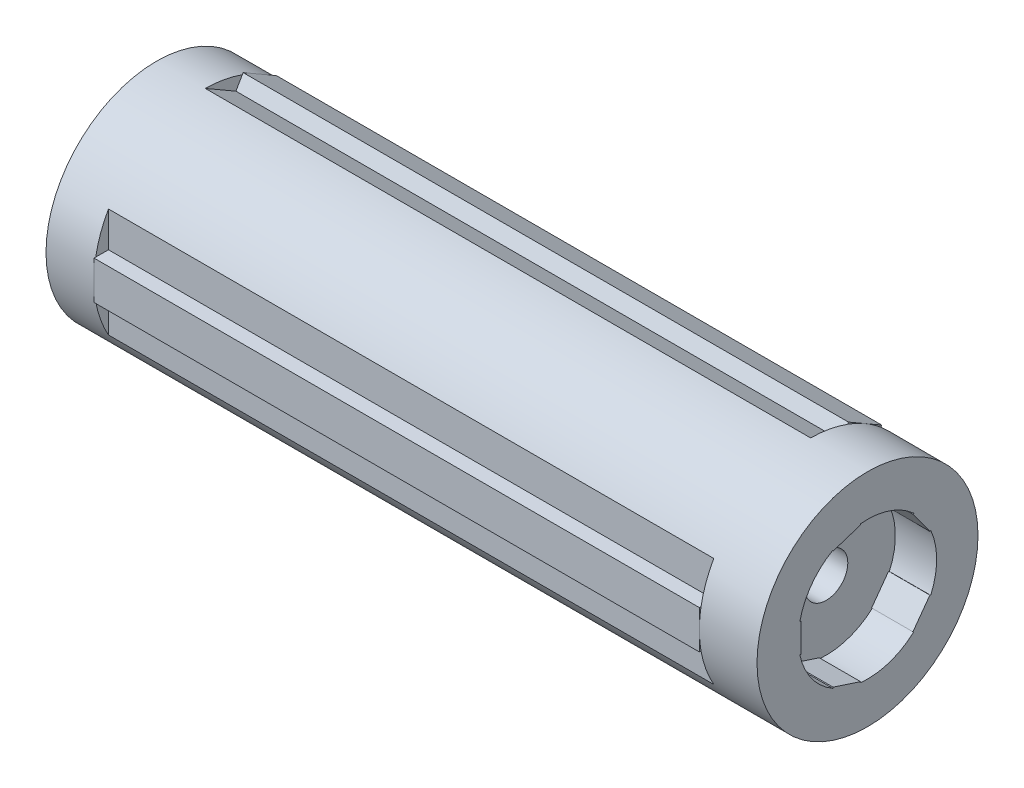
from build123d import *

# Parameters (mm, degrees)
SKIZZE1_R                                 = 11.5
GRUNDK_RPER_WALZE_DEPTH                   = 74
PRESSPASSUNG_KUGELLAGER_DEPTH             = 4.3
SKIZZE3_R                                 = 2.25
M4_SCHRAUBENF_HRUNG_DEPTH                 = 4.5
SKIZZE4_R                                 = 9.6
MOTORAUSSPARUNG_DEPTH                     = 12.75
ZERST_RUNGSELEMENT_START                  = -6
SKIZZE7_W                                 = 1.5
SKIZZE7_H                                 = 15
ZERST_RUNGSELEMENT_AUSSPARUNG_DEPTH       = 63
SKIZZE8_W                                 = 63
SKIZZE8_H                                 = 4
ZERST_RUNGSELEMENT_RECHTECK_DEPTH         = 1.5
M5_MOTOR_MUTTER_DEPTH                     = 12
SKIZZE12_R                                = 3.1
M5_AUSLAUF_SCHRAUBE_DEPTH                 = 2
ZERST_RUNGSELEMENT_VERVIELF_LTIGUNG_COUNT = 3
SKIZZE13_R                                = 8.5
INNENAUSPARUNG_HOHL_DEPTH                 = 38


with BuildPart() as part:
    # Skizze1 → Grundkörper Walze (new body)
    with BuildSketch(Plane(origin=(0, 0, 0), x_dir=(0, 0, -1), z_dir=(1, 0, 0))):
        Circle(SKIZZE1_R)
    extrude(amount=GRUNDK_RPER_WALZE_DEPTH)

    # Skizze2 → Presspassung Kugellager (cut)
    with BuildSketch(Plane(origin=(74, 0, 0), x_dir=(0, 0, -1), z_dir=(1, 0, 0))):
        with BuildLine():
            Line((-7.040453047, 1.507322425), (-6.940453047, 1.507322425))
            Line((-6.940453047, 1.507322425), (-6.940453047, -1.492677575))
            Line((-6.940453047, -1.492677575), (-7.043572507, -1.492677575))
            ThreePointArc((-7.043572507, -1.492677575), (-5.829319782, -4.225994662), (-3.609168454, -6.230080503))
            Line((-3.609168454, -6.230080503), (-3.578266755, -6.134974851))
            Line((-3.578266755, -6.134974851), (-0.725097206, -7.062025834))
            Line((-0.725097206, -7.062025834), (-0.756962871, -7.160098268))
            ThreePointArc((-0.756962871, -7.160098268), (2.217800882, -6.849916733), (4.809864271, -5.357723928))
            Line((4.809864271, -5.357723928), (4.728962572, -5.298945403))
            Line((4.728962572, -5.298945403), (6.492318329, -2.87189442))
            Line((6.492318329, -2.87189442), (6.575743724, -2.932506518))
            ThreePointArc((6.575743724, -2.932506518), (7.199996108, -0.007486699), (6.581828055, 2.918825013))
            Line((6.581828055, 2.918825013), (6.500926356, 2.860046487))
            Line((6.500926356, 2.860046487), (4.737570599, 5.28709747))
            Line((4.737570599, 5.28709747), (4.820995994, 5.347709568))
            ThreePointArc((4.820995994, 5.347709568), (2.232041431, 6.845289698), (-0.742070825, 7.161656993))
            Line((-0.742070825, 7.161656993), (-0.711169126, 7.066551342))
            Line((-0.711169126, 7.066551342), (-3.564338674, 6.139500359))
            Line((-3.564338674, 6.139500359), (-3.59620434, 6.237572793))
            ThreePointArc((-3.59620434, 6.237572793), (-5.820518639, 4.238108396), (-7.040453047, 1.507322425))
        make_face()
    extrude(amount=-PRESSPASSUNG_KUGELLAGER_DEPTH, mode=Mode.SUBTRACT)

    # Skizze3 → M4 Schraubenführung (cut)
    with BuildSketch(Plane(origin=(69.7, 0, 0), x_dir=(0, 0, -1), z_dir=(1, 0, 0))):
        Circle(SKIZZE3_R)
    extrude(amount=-M4_SCHRAUBENF_HRUNG_DEPTH, mode=Mode.SUBTRACT)

    # Skizze4 → Motoraussparung (cut)
    with BuildSketch(Plane.ZY):
        Circle(SKIZZE4_R)
    extrude(amount=-MOTORAUSSPARUNG_DEPTH, mode=Mode.SUBTRACT)

    # Skizze7 → Zerstörungselement Aussparung (cut)
    with BuildSketch(Plane(origin=(74, 0, 0), x_dir=(0, 0, -1), z_dir=(1, 0, 0)).offset(ZERST_RUNGSELEMENT_START)):
        with Locations((-10.75, 0)):
            Rectangle(SKIZZE7_W, SKIZZE7_H)
    zerst_rungselement_aussparung = extrude(amount=-ZERST_RUNGSELEMENT_AUSSPARUNG_DEPTH, mode=Mode.SUBTRACT)

    # Skizze8 → Zerstörungselement Rechteck (add)
    with BuildSketch(Plane.XY.offset(10)):
        with Locations((36.5, 0)):
            Rectangle(SKIZZE8_W, SKIZZE8_H)
    zerst_rungselement_rechteck = extrude(amount=ZERST_RUNGSELEMENT_RECHTECK_DEPTH)

    # Skizze10 → M5 Motor Mutter (cut)
    with BuildSketch(Plane.ZY.offset(-12.75)):
        Polygon((4.139835299, -2.29675794), (4.058968371, 2.436823566), (-0.080866927, 4.733581506), (-4.139835299, 2.29675794), (-4.058968371, -2.436823566), (0.080866927, -4.733581506), align=None)
    extrude(amount=-M5_MOTOR_MUTTER_DEPTH, mode=Mode.SUBTRACT)

    # Skizze12 → M5 Auslauf Schraube (cut)
    with BuildSketch(Plane.ZY.offset(-24.75)):
        Circle(SKIZZE12_R)
    extrude(amount=-M5_AUSLAUF_SCHRAUBE_DEPTH, mode=Mode.SUBTRACT)

    # Zerstörungselement Vervielfältigung: Zerstörungselement Aussparung, Zerstörungselement Rechteck ×3 about axis
    zerst_rungselement_vervielf_ltigung_axis = Axis((0, 0, 0), (1, 0, 0))
    add([zerst_rungselement_aussparung.rotate(zerst_rungselement_vervielf_ltigung_axis, i * 360 / ZERST_RUNGSELEMENT_VERVIELF_LTIGUNG_COUNT) for i in range(1, ZERST_RUNGSELEMENT_VERVIELF_LTIGUNG_COUNT)], mode=Mode.SUBTRACT)
    add([zerst_rungselement_rechteck.rotate(zerst_rungselement_vervielf_ltigung_axis, i * 360 / ZERST_RUNGSELEMENT_VERVIELF_LTIGUNG_COUNT) for i in range(1, ZERST_RUNGSELEMENT_VERVIELF_LTIGUNG_COUNT)])

    # Skizze13 → Innenausparung hohl (cut)
    with BuildSketch(Plane(origin=(65.2, 0, 0), x_dir=(0, 0, -1), z_dir=(1, 0, 0))):
        Circle(SKIZZE13_R)
    extrude(amount=-INNENAUSPARUNG_HOHL_DEPTH, mode=Mode.SUBTRACT)


solid = part.part
